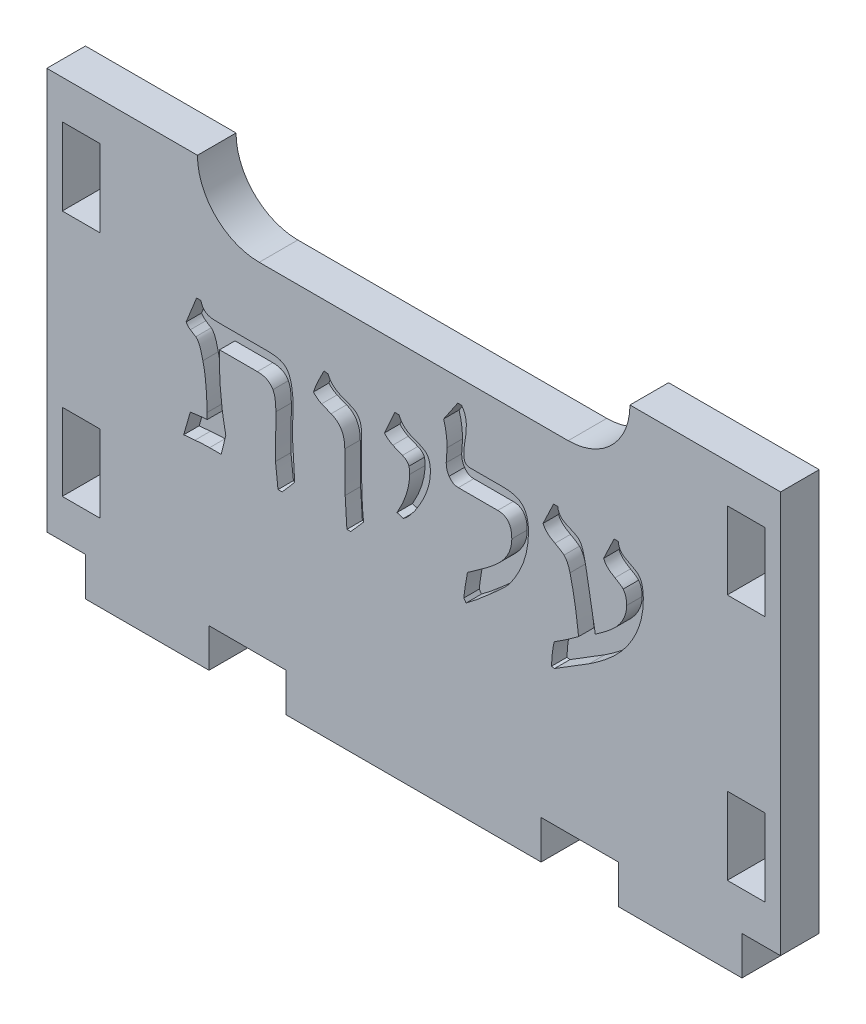
from build123d import *

# Parameters (mm, degrees)
SKETCH1_W           = 120.65
SKETCH1_H           = 66.04
BOSS_EXTRUDE1_DEPTH = 6.35
CUT_EXTRUDE1_REACH  = 139.688
SKETCH2_W           = 6.223
SKETCH2_H           = 12.7
SKETCH4_W           = 20.32
SKETCH4_H           = 6.35
SKETCH4_W_2         = 41.91
BOSS_EXTRUDE2_DEPTH = 6.35
CUT_EXTRUDE2_DEPTH  = 2.54
CUT_EXTRUDE3_DEPTH  = 138.688149952


with BuildPart() as part:
    # Sketch1 → Boss-Extrude1 (new body)
    with BuildSketch(Plane.XY):
        with Locations((-60.325, 33.02)):
            Rectangle(SKETCH1_W, SKETCH1_H)
    extrude(amount=BOSS_EXTRUDE1_DEPTH)

    # Sketch2 → Cut-Extrude1 (cut, up to next)
    with BuildSketch(Plane.XY.offset(6.35), mode=Mode.PRIVATE) as cut_extrude1_sk1:
        with Locations((-114.9985, 12.7)):
            Rectangle(SKETCH2_W, SKETCH2_H)
    cut_extrude1_tool1 = extrude(cut_extrude1_sk1.sketch, amount=-CUT_EXTRUDE1_REACH, mode=Mode.PRIVATE) & part.part
    # Sketch2 → Cut-Extrude1 (cut, up to next)
    with BuildSketch(Plane.XY.offset(6.35), mode=Mode.PRIVATE) as cut_extrude1_sk2:
        with Locations((-114.9985, 53.34)):
            Rectangle(SKETCH2_W, SKETCH2_H)
    cut_extrude1_tool2 = extrude(cut_extrude1_sk2.sketch, amount=-CUT_EXTRUDE1_REACH, mode=Mode.PRIVATE) & part.part
    # Sketch2 → Cut-Extrude1 (cut, up to next)
    with BuildSketch(Plane.XY.offset(6.35), mode=Mode.PRIVATE) as cut_extrude1_sk3:
        with Locations((-5.6515, 53.34)):
            Rectangle(SKETCH2_W, SKETCH2_H)
    cut_extrude1_tool3 = extrude(cut_extrude1_sk3.sketch, amount=-CUT_EXTRUDE1_REACH, mode=Mode.PRIVATE) & part.part
    # Sketch2 → Cut-Extrude1 (cut, up to next)
    with BuildSketch(Plane.XY.offset(6.35), mode=Mode.PRIVATE) as cut_extrude1_sk4:
        with Locations((-5.6515, 12.7)):
            Rectangle(SKETCH2_W, SKETCH2_H)
    cut_extrude1_tool4 = extrude(cut_extrude1_sk4.sketch, amount=-CUT_EXTRUDE1_REACH, mode=Mode.PRIVATE) & part.part
    add(cut_extrude1_tool1.solids().sort_by_distance((-114.9985, 12.7, 6.35))[0], mode=Mode.SUBTRACT)
    add(cut_extrude1_tool2.solids().sort_by_distance((-114.9985, 53.34, 6.35))[0], mode=Mode.SUBTRACT)
    add(cut_extrude1_tool3.solids().sort_by_distance((-5.6515, 53.34, 6.35))[0], mode=Mode.SUBTRACT)
    add(cut_extrude1_tool4.solids().sort_by_distance((-5.6515, 12.7, 6.35))[0], mode=Mode.SUBTRACT)

    # Sketch4 → Boss-Extrude2 (add)
    with BuildSketch(Plane.XZ):
        with Locations((-104.14, 3.175)):
            Rectangle(SKETCH4_W, SKETCH4_H)
        with Locations((-60.325, 3.175)):
            Rectangle(SKETCH4_W_2, SKETCH4_H)
        with Locations((-16.51, 3.175)):
            Rectangle(SKETCH4_W, SKETCH4_H)
    extrude(amount=BOSS_EXTRUDE2_DEPTH)

    # Sketch5 → Cut-Extrude2 (cut)
    with BuildSketch(Plane.XY.offset(6.35)):
        with BuildLine():
            Line((-79.889864865, 27.459459459), (-81.9546875, 25.056756757))
            Line((-81.9546875, 25.056756757), (-82.635810811, 25.056756757))
            add(Edge.make_bspline(
                [(-82.635810811, 25.056756757), (-82.66785403, 25.321355932), (-82.728474935, 25.821937403), (-82.815807836, 26.525912845), (-82.883777393, 27.139518484), (-82.944656922, 27.657547335), (-82.987732743, 28.085037315), (-83.017829441, 28.419469819), (-83.044236958, 28.662214683), (-83.047519022, 28.793069779), (-83.048775338, 28.843158784)],
                knots=[0, 0, 0, 0, 1.679180359, 3.176754326, 4.469037184, 5.568533053, 6.462846369, 7.175614727, 7.684439976, 8, 8, 8, 8], degree=3))
            add(Edge.make_bspline(
                [(-83.048775338, 28.843158784), (-83.048721642, 28.907516445), (-83.048593369, 29.061259747), (-83.049963924, 29.3276564), (-83.042569362, 29.665500872), (-83.036290532, 30.074880275), (-83.03954267, 30.55581301), (-83.033417953, 31.110033186), (-83.019179299, 31.73563996), (-83.019158491, 32.409722006), (-83.00427573, 33.083602649), (-83.001240043, 33.7093546), (-82.995521397, 34.261757653), (-82.989985502, 34.740867425), (-82.985576861, 35.148478817), (-82.977832261, 35.484533825), (-82.979237527, 35.747355103), (-82.979108017, 35.897522963), (-82.979054054, 35.960092905)],
                knots=[0, 0, 0, 0, 0.434034008, 1.036859018, 1.796514212, 2.712887544, 3.797972563, 5.03985061, 6.450667213, 8.018058611, 9.585589113, 10.99625116, 12.238129207, 13.311225457, 14.227598788, 14.987253982, 15.578022493, 16, 16, 16, 16], degree=3))
            add(Edge.make_bspline(
                [(-82.979054054, 35.960092905), (-82.984562785, 36.269726875), (-82.994812325, 36.845831546), (-83.084727141, 37.644541156), (-83.224723972, 38.317519113), (-83.39512149, 38.69909645), (-83.472466216, 38.872297297)],
                knots=[0, 0, 0, 0, 1.246985142, 2.320139378, 3.237498526, 4, 4, 4, 4], degree=3))
            add(Edge.make_bspline(
                [(-83.472466216, 38.872297297), (-83.533764513, 38.974552732), (-83.655089306, 39.176942033), (-83.888638382, 39.440072179), (-84.156178362, 39.663999403), (-84.459139313, 39.848679187), (-84.802331853, 39.986585879), (-85.180012404, 40.089382851), (-85.594559741, 40.146518379), (-85.882153715, 40.155051799), (-86.030701014, 40.159459459)],
                knots=[0, 0, 0, 0, 0.946425686, 1.873215192, 2.781502285, 3.712859963, 4.681761181, 5.712908682, 6.818677477, 8, 8, 8, 8], degree=3))
            Line((-86.030701014, 40.159459459), (-92.246621622, 40.159459459))
            add(Edge.make_bspline(
                [(-92.246621622, 40.159459459), (-92.252568678, 40.079041379), (-92.265641278, 39.902269319), (-92.273273315, 39.608830787), (-92.287565114, 39.263922043), (-92.28534534, 39.015335438), (-92.284163851, 38.883023649)],
                knots=[0, 0, 0, 0, 0.757447694, 1.664993594, 2.757178112, 4, 4, 4, 4], degree=3))
            add(Edge.make_bspline(
                [(-92.284163851, 38.883023649), (-92.273292899, 37.986913462), (-92.25178244, 36.213771421), (-92.034816977, 33.583234121), (-91.716620544, 31.008118536), (-91.382543633, 29.324172392), (-91.216891892, 28.489189189)],
                knots=[0, 0, 0, 0, 1.027131953, 2.032396099, 3.024365349, 4, 4, 4, 4], degree=3))
            add(Edge.make_bspline(
                [(-91.216891892, 28.489189189), (-91.262414043, 28.278018135), (-91.360660168, 27.822267752), (-91.539484201, 27.09718011), (-91.749770385, 26.278665983), (-91.902903596, 25.70379007), (-91.983826014, 25.4)],
                knots=[0, 0, 0, 0, 0.814282498, 1.757388394, 2.814904016, 4, 4, 4, 4], degree=3))
            Line((-91.983826014, 25.4), (-93.887753378, 25.4))
            add(Edge.make_bspline(
                [(-93.887753378, 25.4), (-94.057628893, 25.399684922), (-94.419036056, 25.399014601), (-94.989127995, 25.366363367), (-95.618998468, 25.333226048), (-96.056377939, 25.292552724), (-96.285092905, 25.271283784)],
                knots=[0, 0, 0, 0, 0.848634405, 1.805454731, 2.852425909, 4, 4, 4, 4], degree=3))
            Line((-96.285092905, 25.271283784), (-98.140751689, 25.110388514))
            Line((-98.140751689, 25.110388514), (-97.052027027, 28.896790541))
            add(Edge.make_bspline(
                [(-97.052027027, 28.896790541), (-96.869610377, 28.917807187), (-96.529676238, 28.95697179), (-96.058332703, 29.017703131), (-95.66257041, 29.064904462), (-95.347557884, 29.104007711), (-95.105489167, 29.128106361), (-94.954576837, 29.170161185), (-94.855204508, 29.150843738), (-94.833428203, 29.173822789), (-94.831672297, 29.175675676)],
                knots=[0, 0, 0, 0, 1.967693249, 3.666804041, 5.095015566, 6.233323303, 7.08411999, 7.663975879, 7.972905114, 8, 8, 8, 8], degree=3))
            Line((-94.831672297, 29.175675676), (-94.306081081, 29.175675676))
            Line((-94.306081081, 29.175675676), (-94.306081081, 30.194679054))
            add(Edge.make_bspline(
                [(-94.306081081, 30.194679054), (-94.308078576, 30.536160105), (-94.312001278, 31.206764004), (-94.344544499, 32.190302984), (-94.39771272, 33.132753336), (-94.472607259, 34.034103319), (-94.567500175, 34.89460695), (-94.686554134, 35.713635767), (-94.822874577, 36.490688015), (-94.936937553, 36.992021688), (-94.992567568, 37.236528716)],
                knots=[0, 0, 0, 0, 1.155781368, 2.269734997, 3.330366347, 4.350437698, 5.330698874, 6.260016284, 7.151387052, 8, 8, 8, 8], degree=3))
            add(Edge.make_bspline(
                [(-94.992567568, 37.236528716), (-95.034035749, 37.428146987), (-95.112651987, 37.791420878), (-95.246139384, 38.301606697), (-95.385559387, 38.74909943), (-95.527304627, 39.135556799), (-95.677228398, 39.458106261), (-95.826349412, 39.721805756), (-95.983012177, 39.925388506), (-96.106230619, 40.020207052), (-96.161739865, 40.062922297)],
                knots=[0, 0, 0, 0, 1.511924906, 2.866338598, 4.065540048, 5.125749369, 6.038648832, 6.804820916, 7.461578243, 8, 8, 8, 8], degree=3))
            add(Edge.make_bspline(
                [(-96.161739865, 40.062922297), (-96.277949568, 40.134417908), (-96.483736005, 40.261023749), (-96.748988706, 40.424433934), (-96.9272465, 40.537896865), (-97.01629138, 40.595635292), (-97.046663851, 40.615329392)],
                knots=[0, 0, 0, 0, 1.569471622, 2.779251348, 3.583612742, 4, 4, 4, 4], degree=3))
            add(Edge.make_bspline(
                [(-97.046663851, 40.615329392), (-97.194952258, 40.730795143), (-97.470043514, 40.944996774), (-97.653807715, 41.240629112), (-97.738513514, 41.376900338)],
                knots=[0, 0, 0, 0, 1.07810338, 2, 2, 2, 2], degree=3))
            Line((-97.738513514, 41.376900338), (-96.022297297, 45.651351351))
            Line((-96.022297297, 45.651351351), (-95.335810811, 45.651351351))
            add(Edge.make_bspline(
                [(-95.335810811, 45.651351351), (-95.280301561, 45.473200419), (-95.175026553, 45.135331671), (-94.91488445, 44.696674785), (-94.578909821, 44.352126974), (-94.300439237, 44.220703421), (-94.161275338, 44.155025338)],
                knots=[0, 0, 0, 0, 1.129898989, 2.14288835, 3.071920292, 4, 4, 4, 4], degree=3))
            add(Edge.make_bspline(
                [(-94.161275338, 44.155025338), (-94.052927494, 44.119930309), (-93.799775858, 44.03793178), (-93.345897175, 43.979209681), (-92.776438143, 43.945059116), (-92.357562802, 43.938642213), (-92.128631757, 43.935135135)],
                knots=[0, 0, 0, 0, 0.664464924, 1.552503278, 2.66235147, 4, 4, 4, 4], degree=3))
            Line((-92.128631757, 43.935135135), (-84.271579392, 43.935135135))
            add(Edge.make_bspline(
                [(-84.271579392, 43.935135135), (-84.092702612, 43.931936328), (-83.74871247, 43.92578484), (-83.256173884, 43.882449215), (-82.808533221, 43.816673984), (-82.408731525, 43.71328148), (-82.053214336, 43.587162364), (-81.742161925, 43.430531367), (-81.474792525, 43.245123728), (-81.332002737, 43.092136471), (-81.262837838, 43.018032095)],
                knots=[0, 0, 0, 0, 1.325602991, 2.549209354, 3.662372855, 4.674681574, 5.605210044, 6.452593117, 7.250462924, 8, 8, 8, 8], degree=3))
            add(Edge.make_bspline(
                [(-81.262837838, 43.018032095), (-81.173425504, 42.907905659), (-80.98499665, 42.675823607), (-80.760942474, 42.252431529), (-80.577764233, 41.74968462), (-80.422393896, 41.168292662), (-80.309136183, 40.507386312), (-80.224399051, 39.767954357), (-80.170089401, 38.948185926), (-80.165688129, 38.373612692), (-80.163386824, 38.073184122)],
                knots=[0, 0, 0, 0, 0.658412586, 1.387548258, 2.213599601, 3.143212901, 4.181945257, 5.32857397, 6.603184665, 8, 8, 8, 8], degree=3))
            add(Edge.make_bspline(
                [(-80.163386824, 38.073184122), (-80.163046109, 38.037423824), (-80.162211063, 37.949780276), (-80.17162817, 37.794377483), (-80.166712974, 37.592241992), (-80.174381728, 37.341946427), (-80.185652368, 37.047061652), (-80.196325969, 36.703807266), (-80.206866348, 36.315865433), (-80.213519377, 36.040542614), (-80.217018581, 35.895734797)],
                knots=[0, 0, 0, 0, 0.393945428, 0.965505806, 1.714002119, 2.620290678, 3.724041126, 4.965594377, 6.404034739, 8, 8, 8, 8], degree=3))
            add(Edge.make_bspline(
                [(-80.217018581, 35.895734797), (-80.224676031, 35.647258962), (-80.239437949, 35.168250971), (-80.252564407, 34.47809782), (-80.244945186, 33.845163187), (-80.236923258, 33.442968856), (-80.233108108, 33.251689189)],
                knots=[0, 0, 0, 0, 1.128036325, 2.174611517, 3.131863199, 4, 4, 4, 4], degree=3))
            add(Edge.make_bspline(
                [(-80.233108108, 33.251689189), (-80.230042562, 33.126529066), (-80.223077051, 32.842141125), (-80.198114781, 32.365024558), (-80.176302782, 31.788915034), (-80.125380225, 31.113911718), (-80.090607547, 30.340804014), (-80.025056123, 29.469019396), (-79.964166974, 28.497940587), (-79.915444184, 27.816968017), (-79.889864865, 27.459459459)],
                knots=[0, 0, 0, 0, 0.517785574, 1.176508693, 1.975907315, 2.902038157, 3.975787001, 5.176360088, 6.517597514, 8, 8, 8, 8], degree=3))
        make_face()
        with BuildLine():
            Line((-68.562837838, 27.459459459), (-70.675929054, 25.056756757))
            Line((-70.675929054, 25.056756757), (-71.308783784, 25.056756757))
            add(Edge.make_bspline(
                [(-71.308783784, 25.056756757), (-71.317524867, 25.185486841), (-71.336223705, 25.460864952), (-71.370558312, 25.902159484), (-71.400212494, 26.401228452), (-71.439750018, 26.956962345), (-71.476549212, 27.570211336), (-71.514487092, 28.240593444), (-71.550354425, 28.970169985), (-71.578441567, 29.47602884), (-71.593032095, 29.738809122)],
                knots=[0, 0, 0, 0, 0.660150716, 1.41218782, 2.264602325, 3.218014702, 4.262705963, 5.407838729, 6.653440849, 8, 8, 8, 8], degree=3))
            add(Edge.make_bspline(
                [(-71.593032095, 29.738809122), (-71.598990411, 29.880022243), (-71.612562326, 30.201678991), (-71.619790012, 30.741732293), (-71.633066316, 31.397763715), (-71.635583982, 32.166547439), (-71.641929377, 33.049671023), (-71.64657519, 34.045439417), (-71.653627135, 35.157395949), (-71.65257804, 35.936851096), (-71.652027027, 36.346241554)],
                knots=[0, 0, 0, 0, 0.513313115, 1.16923007, 1.96147694, 2.896484917, 3.961349232, 5.169056203, 6.513113445, 8, 8, 8, 8], degree=3))
            add(Edge.make_bspline(
                [(-71.652027027, 36.346241554), (-71.65969018, 36.586126911), (-71.674404722, 37.046747111), (-71.772996917, 37.705700604), (-71.94949837, 38.296814555), (-72.198382001, 38.820332243), (-72.518153289, 39.280427576), (-72.914888544, 39.667435023), (-73.378144908, 39.99505304), (-73.729527153, 40.142669356), (-73.909923986, 40.218454392)],
                knots=[0, 0, 0, 0, 1.198315691, 2.300967508, 3.318023051, 4.268689061, 5.185401603, 6.101069557, 7.025104304, 8, 8, 8, 8], degree=3))
            add(Edge.make_bspline(
                [(-73.909923986, 40.218454392), (-74.096043455, 40.289471647), (-74.431355759, 40.417416131), (-74.876417328, 40.594601738), (-75.210420676, 40.730997418), (-75.3921831, 40.816814001), (-75.465244932, 40.851309122)],
                knots=[0, 0, 0, 0, 1.423232872, 2.564092285, 3.422817729, 4, 4, 4, 4], degree=3))
            add(Edge.make_bspline(
                [(-75.465244932, 40.851309122), (-75.601130691, 40.923453043), (-75.864191044, 41.063115988), (-76.217703336, 41.314648768), (-76.537363138, 41.575167356), (-76.713823047, 41.776554161), (-76.800675676, 41.875675676)],
                knots=[0, 0, 0, 0, 1.088336468, 2.10690347, 3.068227956, 4, 4, 4, 4], degree=3))
            add(Edge.make_bspline(
                [(-76.800675676, 41.875675676), (-76.763921173, 41.990358268), (-76.685908471, 42.233776029), (-76.544392295, 42.616529578), (-76.373762881, 43.039106916), (-76.16697173, 43.497573313), (-75.942781347, 44.000270658), (-75.685569858, 44.540444337), (-75.393743248, 45.119519533), (-75.19009591, 45.519142432), (-75.084459459, 45.726435811)],
                knots=[0, 0, 0, 0, 0.684712745, 1.45332644, 2.3197731, 3.27553597, 4.312854072, 5.449606447, 6.677053547, 8, 8, 8, 8], degree=3))
            Line((-75.084459459, 45.726435811), (-74.397972973, 45.651351351))
            add(Edge.make_bspline(
                [(-74.397972973, 45.651351351), (-74.350432367, 45.537492429), (-74.255934868, 45.311172565), (-74.069924232, 44.994391574), (-73.857121809, 44.693853461), (-73.594735286, 44.428165815), (-73.306042292, 44.179345273), (-72.979227703, 43.958725264), (-72.618741906, 43.758656352), (-72.359301332, 43.648525494), (-72.225886824, 43.591891892)],
                knots=[0, 0, 0, 0, 0.958317934, 1.904869452, 2.850195395, 3.813641018, 4.799684404, 5.809829576, 6.873728554, 8, 8, 8, 8], degree=3))
            add(Edge.make_bspline(
                [(-72.225886824, 43.591891892), (-72.06995361, 43.535738881), (-71.772829489, 43.428741702), (-71.356655096, 43.260313284), (-70.984233208, 43.109840846), (-70.65771918, 42.974845543), (-70.382101861, 42.838421937), (-70.154347794, 42.71513764), (-69.966038001, 42.612348796), (-69.867055174, 42.532981246), (-69.823184122, 42.497804054)],
                knots=[0, 0, 0, 0, 1.501745556, 2.861512403, 4.067866281, 5.142108415, 6.062253119, 6.852258182, 7.491299216, 8, 8, 8, 8], degree=3))
            add(Edge.make_bspline(
                [(-69.823184122, 42.497804054), (-69.749904828, 42.431647126), (-69.602986027, 42.299008066), (-69.412778832, 42.065641808), (-69.258681774, 41.799626153), (-69.128570144, 41.506758577), (-69.026759781, 41.184982413), (-68.959029238, 40.832150932), (-68.915717256, 40.451928952), (-68.909359371, 40.188187743), (-68.906081081, 40.052195946)],
                knots=[0, 0, 0, 0, 0.876831871, 1.757973936, 2.662873769, 3.60201546, 4.60223751, 5.655712014, 6.791224401, 8, 8, 8, 8], degree=3))
            add(Edge.make_bspline(
                [(-68.906081081, 40.052195946), (-68.906081081, 39.910965653), (-68.906081081, 39.603476914), (-68.906081081, 39.101126126), (-68.906081081, 38.520115428), (-68.906081081, 37.889048423), (-68.906081081, 37.266920045), (-68.906081081, 36.7109375), (-68.906081081, 36.249704392), (-68.906081081, 35.974394707), (-68.906081081, 35.852829392)],
                knots=[0, 0, 0, 0, 0.80715198, 1.75734355, 2.87100894, 4.127713921, 5.363984674, 6.426564496, 7.305236271, 8, 8, 8, 8], degree=3))
            add(Edge.make_bspline(
                [(-68.906081081, 35.852829392), (-68.905143638, 35.382652518), (-68.903339982, 34.478023701), (-68.887091533, 33.171138378), (-68.861117478, 31.967911884), (-68.824059995, 30.866567362), (-68.776682806, 29.868840904), (-68.718435748, 28.974789466), (-68.651088504, 28.182304999), (-68.590976069, 27.689934715), (-68.562837838, 27.459459459)],
                knots=[0, 0, 0, 0, 1.342516136, 2.583025349, 3.73184102, 4.778891276, 5.729455327, 6.583768653, 7.337071524, 8, 8, 8, 8], degree=3))
        make_face()
        with BuildLine():
            add(Edge.make_bspline(
                [(-57.579054054, 40.068285473), (-57.58497832, 39.866095325), (-57.597022276, 39.45504533), (-57.672574341, 38.829992961), (-57.811353829, 38.189828271), (-57.995174834, 37.529544752), (-58.222008073, 36.847764864), (-58.519214644, 36.155589519), (-58.854467788, 35.439252597), (-59.113850096, 34.964770483), (-59.247001689, 34.721199324)],
                knots=[0, 0, 0, 0, 0.857309814, 1.742899933, 2.664537085, 3.631764291, 4.64802541, 5.707976292, 6.823410083, 8, 8, 8, 8], degree=3))
            add(Edge.make_bspline(
                [(-59.247001689, 34.721199324), (-59.366980151, 34.512859527), (-59.598850707, 34.110221721), (-59.961216242, 33.54147048), (-60.309695799, 33.018945067), (-60.666736554, 32.560078634), (-61.008051985, 32.146623454), (-61.354142479, 31.792019783), (-61.691441629, 31.484528184), (-61.928753105, 31.315322545), (-62.041216216, 31.235135135)],
                knots=[0, 0, 0, 0, 1.280911276, 2.475491065, 3.593146524, 4.62585021, 5.572354112, 6.448143302, 7.26456725, 8, 8, 8, 8], degree=3))
            Line((-62.041216216, 31.235135135), (-63.070945946, 31.573015203))
            add(Edge.make_bspline(
                [(-63.070945946, 31.573015203), (-62.906776673, 31.86267786), (-62.585664663, 32.429252568), (-62.170975504, 33.287059544), (-61.810413744, 34.122483779), (-61.52318547, 34.940372978), (-61.293461578, 35.73842776), (-61.133129819, 36.516502409), (-61.030945839, 37.274923945), (-61.017894849, 37.774330994), (-61.011486486, 38.019552365)],
                knots=[0, 0, 0, 0, 1.16727949, 2.283176719, 3.339308336, 4.35646626, 5.320927941, 6.249197264, 7.140311997, 8, 8, 8, 8], degree=3))
            add(Edge.make_bspline(
                [(-61.011486486, 38.019552365), (-61.01253888, 38.150062659), (-61.014457255, 38.387965613), (-61.026929666, 38.708711383), (-61.057593759, 38.957969304), (-61.089307965, 39.097710796), (-61.102660473, 39.156545608)],
                knots=[0, 0, 0, 0, 1.369697807, 2.496777428, 3.367104093, 4, 4, 4, 4], degree=3))
            add(Edge.make_bspline(
                [(-61.102660473, 39.156545608), (-61.146757881, 39.265600503), (-61.235384832, 39.484778984), (-61.48371364, 39.756222963), (-61.794158706, 39.993959619), (-62.043499909, 40.10223024), (-62.175295608, 40.159459459)],
                knots=[0, 0, 0, 0, 0.924012154, 1.85707924, 2.86730417, 4, 4, 4, 4], degree=3))
            add(Edge.make_bspline(
                [(-62.175295608, 40.159459459), (-62.364739176, 40.234676701), (-62.706292163, 40.370287921), (-63.162448824, 40.549389613), (-63.501354721, 40.694506895), (-63.687817232, 40.779564434), (-63.762795608, 40.813766892)],
                knots=[0, 0, 0, 0, 1.424306726, 2.567921532, 3.424147421, 4, 4, 4, 4], degree=3))
            add(Edge.make_bspline(
                [(-63.762795608, 40.813766892), (-63.901800688, 40.890135203), (-64.170370565, 41.037685407), (-64.540147221, 41.290400514), (-64.858266083, 41.570316129), (-65.041135604, 41.775508652), (-65.130405405, 41.875675676)],
                knots=[0, 0, 0, 0, 1.091511593, 2.108895115, 3.076836015, 4, 4, 4, 4], degree=3))
            add(Edge.make_bspline(
                [(-65.130405405, 41.875675676), (-65.076229301, 41.986257182), (-64.962227589, 42.218951671), (-64.793506192, 42.592065404), (-64.595832403, 43.000252944), (-64.391060807, 43.451992386), (-64.167365818, 43.944510832), (-63.935792967, 44.480009663), (-63.675356864, 45.050947736), (-63.502958854, 45.447276984), (-63.414189189, 45.651351351)],
                knots=[0, 0, 0, 0, 0.712484684, 1.499267515, 2.369177506, 3.336581618, 4.369049288, 5.499190202, 6.712305038, 8, 8, 8, 8], degree=3))
            Line((-63.414189189, 45.651351351), (-62.727702703, 45.651351351))
            add(Edge.make_bspline(
                [(-62.727702703, 45.651351351), (-62.680391138, 45.535601226), (-62.58696099, 45.307019666), (-62.399530091, 44.989083383), (-62.18688739, 44.688470716), (-61.924447393, 44.422825561), (-61.635806676, 44.173908047), (-61.308831091, 43.953648049), (-60.949608862, 43.752488572), (-60.68920353, 43.646343779), (-60.555616554, 43.591891892)],
                knots=[0, 0, 0, 0, 0.970172071, 1.915880816, 2.860365078, 3.822952885, 4.808118336, 5.817364113, 6.880315837, 8, 8, 8, 8], degree=3))
            add(Edge.make_bspline(
                [(-60.555616554, 43.591891892), (-60.414266219, 43.538577935), (-60.145252813, 43.43711253), (-59.761917918, 43.286878565), (-59.419800509, 43.143309551), (-59.118439336, 43.005292051), (-58.861076282, 42.868961419), (-58.639987307, 42.748631768), (-58.459834385, 42.630905099), (-58.359632594, 42.546932209), (-58.313809122, 42.508530405)],
                knots=[0, 0, 0, 0, 1.449963152, 2.75952319, 3.95138556, 5.010770744, 5.939388824, 6.746017368, 7.426538805, 8, 8, 8, 8], degree=3))
            add(Edge.make_bspline(
                [(-58.313809122, 42.508530405), (-58.25470497, 42.445737099), (-58.133660462, 42.317137251), (-57.98493771, 42.090187598), (-57.860976368, 41.831198303), (-57.753219947, 41.543118489), (-57.673349327, 41.21914055), (-57.624306876, 40.86308883), (-57.582514177, 40.476841278), (-57.580236143, 40.207861295), (-57.579054054, 40.068285473)],
                knots=[0, 0, 0, 0, 0.790390688, 1.618709519, 2.477356297, 3.422298148, 4.437175457, 5.532569598, 6.719631017, 8, 8, 8, 8], degree=3))
        make_face()
        with BuildLine():
            add(Edge.make_bspline(
                [(-41.446621622, 39.596326014), (-41.457842635, 39.199027303), (-41.480211828, 38.407008656), (-41.632971767, 37.225240925), (-41.893946721, 36.060579304), (-42.246426622, 34.906750785), (-42.712122981, 33.772752982), (-43.278203154, 32.654706486), (-43.944339585, 31.5494936), (-44.457162046, 30.843566355), (-44.718158784, 30.484290541)],
                knots=[0, 0, 0, 0, 0.967274877, 1.928271393, 2.895634406, 3.8704016, 4.862172978, 5.876347502, 6.919184678, 8, 8, 8, 8], degree=3))
            add(Edge.make_bspline(
                [(-44.718158784, 30.484290541), (-44.774604936, 30.415682929), (-44.905808724, 30.25621097), (-45.152190801, 30.001234333), (-45.459830806, 29.683038822), (-45.851541737, 29.320243567), (-46.309928485, 28.897214484), (-46.843629029, 28.421101904), (-47.440957581, 27.882520795), (-47.87084678, 27.513902411), (-48.096959459, 27.320016892)],
                knots=[0, 0, 0, 0, 0.460045592, 1.069332839, 1.835484985, 2.752588851, 3.833992214, 5.066769608, 6.457182493, 8, 8, 8, 8], degree=3))
            add(Edge.make_bspline(
                [(-48.096959459, 27.320016892), (-48.314865739, 27.132073154), (-48.730561263, 26.77353658), (-49.326988428, 26.265381179), (-49.858866458, 25.805539053), (-50.346931144, 25.417348126), (-50.765907157, 25.071740095), (-51.133183194, 24.789003166), (-51.436082414, 24.553583206), (-51.627071524, 24.426574941), (-51.711739865, 24.37027027)],
                knots=[0, 0, 0, 0, 1.479541071, 2.822491408, 4.028863593, 5.094044901, 6.028587189, 6.821058897, 7.477357705, 8, 8, 8, 8], degree=3))
            Line((-51.711739865, 24.37027027), (-52.087162162, 24.890498311))
            add(Edge.make_bspline(
                [(-52.087162162, 24.890498311), (-52.060023918, 25.144535533), (-52.000280376, 25.703786271), (-51.867811949, 26.613559939), (-51.695140149, 27.673633281), (-51.559198469, 28.428612136), (-51.486486486, 28.832432432)],
                knots=[0, 0, 0, 0, 0.76860356, 1.692043803, 2.765528928, 4, 4, 4, 4], degree=3))
            add(Edge.make_bspline(
                [(-51.486486486, 28.832432432), (-50.965987803, 29.200322703), (-49.922109638, 29.938139402), (-48.881497186, 30.680554959), (-48.359755068, 31.052787162)],
                knots=[0, 0, 0, 0, 0.997240293, 2, 2, 2, 2], degree=3))
            add(Edge.make_bspline(
                [(-48.359755068, 31.052787162), (-48.055272464, 31.285825936), (-47.47495838, 31.729975063), (-46.682355545, 32.410495064), (-46.009805268, 33.072848062), (-45.631779443, 33.532823769), (-45.452913851, 33.750464527)],
                knots=[0, 0, 0, 0, 1.156704088, 2.204564938, 3.150477206, 4, 4, 4, 4], degree=3))
            add(Edge.make_bspline(
                [(-45.452913851, 33.750464527), (-45.259002253, 34.027236203), (-44.882406254, 34.564754879), (-44.492428754, 35.447244284), (-44.23967659, 36.344707853), (-44.208236665, 36.9542143), (-44.192567568, 37.257981419)],
                knots=[0, 0, 0, 0, 1.067502729, 2.073198612, 3.039716629, 4, 4, 4, 4], degree=3))
            add(Edge.make_bspline(
                [(-44.192567568, 37.257981419), (-44.199351351, 37.485456863), (-44.21209813, 37.912884933), (-44.315968538, 38.510897147), (-44.496693947, 39.019399609), (-44.750884108, 39.439501123), (-45.082248158, 39.770125401), (-45.494892835, 39.997364245), (-45.976212007, 40.141412431), (-46.322423285, 40.153248519), (-46.504096284, 40.159459459)],
                knots=[0, 0, 0, 0, 1.288535354, 2.42116762, 3.424298783, 4.329554724, 5.182028878, 6.04402082, 6.973607665, 8, 8, 8, 8], degree=3))
            Line((-46.504096284, 40.159459459), (-52.9828125, 40.159459459))
            add(Edge.make_bspline(
                [(-52.9828125, 40.159459459), (-53.136399461, 40.168847639), (-53.434943955, 40.187096514), (-53.855422438, 40.358964389), (-54.219296962, 40.641832624), (-54.404388432, 40.892594984), (-54.500591216, 41.022930743)],
                knots=[0, 0, 0, 0, 1.00676596, 1.95696583, 2.938116512, 4, 4, 4, 4], degree=3))
            add(Edge.make_bspline(
                [(-54.500591216, 41.022930743), (-54.574446926, 41.145993495), (-54.722953469, 41.393443882), (-54.872311775, 41.807476855), (-54.957606901, 42.251144346), (-54.971048821, 42.55642087), (-54.977913851, 42.712331081)],
                knots=[0, 0, 0, 0, 0.965790308, 1.941978224, 2.948931267, 4, 4, 4, 4], degree=3))
            add(Edge.make_bspline(
                [(-54.977913851, 42.712331081), (-54.976310654, 42.778481967), (-54.97275641, 42.925136657), (-54.962340548, 43.168441392), (-54.940555817, 43.454583423), (-54.897805171, 43.874163477), (-54.843279376, 44.364746481), (-54.83620788, 44.748415825), (-54.833108108, 44.916596284)],
                knots=[0, 0, 0, 0, 0.538964706, 1.194869895, 1.98333418, 2.875859696, 4.63054123, 6, 6, 6, 6], degree=3))
            add(Edge.make_bspline(
                [(-54.833108108, 44.916596284), (-54.84127224, 45.240416469), (-54.857594406, 45.887814945), (-54.960125729, 46.852750216), (-55.135764297, 47.806963435), (-55.309272451, 48.428834389), (-55.396241554, 48.740540541)],
                knots=[0, 0, 0, 0, 1.001951502, 2.003154543, 2.999102613, 4, 4, 4, 4], degree=3))
            Line((-55.396241554, 48.740540541), (-53.063260135, 52.172972973))
            Line((-53.063260135, 52.172972973), (-52.430405405, 52.135430743))
            add(Edge.make_bspline(
                [(-52.430405405, 52.135430743), (-52.313299939, 51.958335288), (-52.078755965, 51.603640727), (-51.838616425, 51.005464084), (-51.695562445, 50.359861017), (-51.677920471, 49.914058), (-51.668834459, 49.684459459)],
                knots=[0, 0, 0, 0, 0.974388204, 1.951547515, 2.945001083, 4, 4, 4, 4], degree=3))
            add(Edge.make_bspline(
                [(-51.668834459, 49.684459459), (-51.679908176, 49.320993584), (-51.702964095, 48.564243148), (-51.842793098, 47.624602083), (-51.968944472, 46.886153119), (-52.031338027, 46.392155111), (-52.08124771, 45.974150195), (-52.08533676, 45.717606833), (-52.087162162, 45.60308277)],
                knots=[0, 0, 0, 0, 1.592538219, 3.315728034, 4.156906197, 4.876110832, 5.498282267, 6, 6, 6, 6], degree=3))
            add(Edge.make_bspline(
                [(-52.087162162, 45.60308277), (-52.085065634, 45.429034854), (-52.081261434, 45.113220846), (-52.008531818, 44.694258593), (-51.918311634, 44.357972684), (-51.789961517, 44.202387562), (-51.733192568, 44.133572635)],
                knots=[0, 0, 0, 0, 1.349011261, 2.447812423, 3.313471161, 4, 4, 4, 4], degree=3))
            add(Edge.make_bspline(
                [(-51.733192568, 44.133572635), (-51.684241162, 44.102582314), (-51.571899612, 44.031460745), (-51.348341159, 43.97391724), (-51.064119289, 43.938369631), (-50.852037528, 43.936281275), (-50.735641892, 43.935135135)],
                knots=[0, 0, 0, 0, 0.670105263, 1.537865208, 2.648720457, 4, 4, 4, 4], degree=3))
            Line((-50.735641892, 43.935135135), (-45.629898649, 43.935135135))
            add(Edge.make_bspline(
                [(-45.629898649, 43.935135135), (-45.46536147, 43.933576), (-45.14654559, 43.930554938), (-44.684175586, 43.893148962), (-44.25640278, 43.828335631), (-43.862440035, 43.745747971), (-43.506205815, 43.631060598), (-43.18179411, 43.497962137), (-42.888774669, 43.339950774), (-42.719602669, 43.206400076), (-42.637246622, 43.141385135)],
                knots=[0, 0, 0, 0, 1.250787105, 2.42359079, 3.523139861, 4.538931326, 5.480339208, 6.363838747, 7.203486546, 8, 8, 8, 8], degree=3))
            add(Edge.make_bspline(
                [(-42.637246622, 43.141385135), (-42.54124302, 43.053051622), (-42.346382721, 42.873759444), (-42.105321886, 42.545122237), (-41.902068692, 42.17042932), (-41.728555283, 41.750895457), (-41.601704099, 41.278289189), (-41.515114897, 40.759033191), (-41.451666801, 40.193172252), (-41.448346014, 39.800322124), (-41.446621622, 39.596326014)],
                knots=[0, 0, 0, 0, 0.810117018, 1.644309603, 2.520454537, 3.458186612, 4.461994504, 5.557327451, 6.731588299, 8, 8, 8, 8], degree=3))
        make_face()
        with BuildLine():
            add(Edge.make_bspline(
                [(-22.568243243, 39.462246622), (-22.580425546, 39.052334191), (-22.604676517, 38.236332902), (-22.774257419, 37.023310972), (-23.059513365, 35.834832255), (-23.460776154, 34.668721369), (-23.97246929, 33.523868239), (-24.596445862, 32.399192641), (-25.341292262, 31.301342016), (-25.906081899, 30.603663896), (-26.19375, 30.248310811)],
                knots=[0, 0, 0, 0, 0.972386281, 1.935702359, 2.899615819, 3.868016476, 4.857203431, 5.871025168, 6.915634942, 8, 8, 8, 8], degree=3))
            add(Edge.make_bspline(
                [(-26.19375, 30.248310811), (-26.356681642, 30.0645437), (-26.689047124, 29.689675787), (-27.22793366, 29.142247119), (-27.813433012, 28.595270185), (-28.446786807, 28.047801156), (-29.130256694, 27.503532566), (-29.851710268, 26.948287837), (-30.627908894, 26.402263384), (-31.164640378, 26.044213637), (-31.438935811, 25.861233108)],
                knots=[0, 0, 0, 0, 0.859136392, 1.752558796, 2.686254801, 3.661811208, 4.680619239, 5.74268554, 6.846404456, 8, 8, 8, 8], degree=3))
            add(Edge.make_bspline(
                [(-31.438935811, 25.861233108), (-32.391944853, 25.271528194), (-34.302149041, 24.08952808), (-36.210527268, 22.904582148), (-37.166807432, 22.310810811)],
                knots=[0, 0, 0, 0, 0.997808557, 2, 2, 2, 2], degree=3))
            Line((-37.166807432, 22.310810811), (-37.670945946, 22.380532095))
            add(Edge.make_bspline(
                [(-37.670945946, 22.380532095), (-37.658134449, 22.698971636), (-37.632684234, 23.331556184), (-37.53708685, 24.268708415), (-37.413676675, 25.187924456), (-37.29168962, 25.788506642), (-37.231165541, 26.086486486)],
                knots=[0, 0, 0, 0, 1.023170131, 2.0325416, 3.023842261, 4, 4, 4, 4], degree=3))
            add(Edge.make_bspline(
                [(-37.231165541, 26.086486486), (-37.111249982, 26.159558705), (-36.856212837, 26.314969148), (-36.452990708, 26.567347747), (-36.008837129, 26.855916812), (-35.527984398, 27.184095027), (-35.00534345, 27.54434256), (-34.44246697, 27.941637133), (-33.838589638, 28.374815001), (-33.423148037, 28.676675197), (-33.208783784, 28.832432432)],
                knots=[0, 0, 0, 0, 0.691758735, 1.47123672, 2.34327564, 3.300776513, 4.338993723, 5.47026615, 6.694679333, 8, 8, 8, 8], degree=3))
            add(Edge.make_bspline(
                [(-33.208783784, 28.832432432), (-33.290763745, 29.571503708), (-33.45211205, 31.026101817), (-33.786605176, 33.160203411), (-34.158864701, 35.217546096), (-34.467498524, 36.552915891), (-34.619298986, 37.209712838)],
                knots=[0, 0, 0, 0, 1.0495187, 2.065603098, 3.048573672, 4, 4, 4, 4], degree=3))
            add(Edge.make_bspline(
                [(-34.619298986, 37.209712838), (-34.672590432, 37.424345729), (-34.773484644, 37.83070018), (-35.005335101, 38.382356421), (-35.264819145, 38.863459701), (-35.498912837, 39.11931689), (-35.611486486, 39.242356419)],
                knots=[0, 0, 0, 0, 1.156549943, 2.189642114, 3.129414414, 4, 4, 4, 4], degree=3))
            add(Edge.make_bspline(
                [(-35.611486486, 39.242356419), (-35.685447805, 39.306375079), (-35.857719592, 39.455488282), (-36.183773824, 39.670303015), (-36.604161463, 39.91599716), (-36.919403774, 40.083815406), (-37.091722973, 40.175548986)],
                knots=[0, 0, 0, 0, 0.66861453, 1.557346772, 2.664785683, 4, 4, 4, 4], degree=3))
            add(Edge.make_bspline(
                [(-37.091722973, 40.175548986), (-37.33965866, 40.315069348), (-37.800700622, 40.574510583), (-38.374860305, 41.039223108), (-38.811210245, 41.515575148), (-38.969756161, 41.877840866), (-39.043918919, 42.047297297)],
                knots=[0, 0, 0, 0, 1.232980747, 2.29275531, 3.201404998, 4, 4, 4, 4], degree=3))
            Line((-39.043918919, 42.047297297), (-37.327702703, 45.651351351))
            Line((-37.327702703, 45.651351351), (-36.641216216, 45.651351351))
            add(Edge.make_bspline(
                [(-36.641216216, 45.651351351), (-36.619143698, 45.501204348), (-36.576462037, 45.210864866), (-36.405233418, 44.811341046), (-36.177503171, 44.449182841), (-35.96196209, 44.26458194), (-35.852829392, 44.171114865)],
                knots=[0, 0, 0, 0, 1.052263293, 2.034763091, 3.004961813, 4, 4, 4, 4], degree=3))
            add(Edge.make_bspline(
                [(-35.852829392, 44.171114865), (-35.776652934, 44.119924068), (-35.598819905, 44.000419766), (-35.278208734, 43.829350697), (-34.871788277, 43.634975287), (-34.569837621, 43.506559908), (-34.404771959, 43.436359797)],
                knots=[0, 0, 0, 0, 0.676723828, 1.579803684, 2.676964941, 4, 4, 4, 4], degree=3))
            add(Edge.make_bspline(
                [(-34.404771959, 43.436359797), (-34.220742764, 43.35573408), (-33.881019058, 43.206896458), (-33.434787006, 42.95292433), (-33.09215657, 42.680760881), (-32.936898102, 42.467228418), (-32.865540541, 42.369087838)],
                knots=[0, 0, 0, 0, 1.267371558, 2.339607927, 3.236875566, 4, 4, 4, 4], degree=3))
            add(Edge.make_bspline(
                [(-32.865540541, 42.369087838), (-32.824755245, 42.292894058), (-32.734733616, 42.124718541), (-32.620909576, 41.829873686), (-32.495869351, 41.479086582), (-32.381547383, 41.059948385), (-32.256238428, 40.582052528), (-32.14241999, 40.036635996), (-32.017101887, 39.433112438), (-31.94029169, 39.008360825), (-31.900168919, 38.786486486)],
                knots=[0, 0, 0, 0, 0.55656307, 1.228450436, 2.033809036, 2.956566648, 4.026944837, 5.218034018, 6.546805139, 8, 8, 8, 8], degree=3))
            Line((-31.900168919, 38.786486486), (-30.462837838, 30.548648649))
            add(Edge.make_bspline(
                [(-30.462837838, 30.548648649), (-30.271431532, 30.682541735), (-29.901567721, 30.941269926), (-29.366364929, 31.320049695), (-28.882036494, 31.693951471), (-28.427436526, 32.03666117), (-28.027749297, 32.378806656), (-27.661145495, 32.694786477), (-27.332761562, 32.990660715), (-27.138386893, 33.193389834), (-27.046494932, 33.289231419)],
                knots=[0, 0, 0, 0, 1.278012206, 2.469565789, 3.586530523, 4.625352581, 5.583356356, 6.46388578, 7.273791447, 8, 8, 8, 8], degree=3))
            add(Edge.make_bspline(
                [(-27.046494932, 33.289231419), (-26.90783246, 33.446091396), (-26.638594142, 33.750663467), (-26.290131078, 34.234585164), (-25.982801528, 34.715312386), (-25.747628954, 35.210603123), (-25.54523885, 35.701579586), (-25.414411093, 36.203240648), (-25.329764138, 36.708048453), (-25.31936149, 37.046696702), (-25.314189189, 37.215076014)],
                knots=[0, 0, 0, 0, 1.142988931, 2.219320144, 3.254546123, 4.254767977, 5.210517391, 6.151026145, 7.080671625, 8, 8, 8, 8], degree=3))
            add(Edge.make_bspline(
                [(-25.314189189, 37.215076014), (-25.321352471, 37.430118468), (-25.334815974, 37.834294196), (-25.434176187, 38.398870736), (-25.602790339, 38.884572814), (-25.789075113, 39.145544032), (-25.877322635, 39.269172297)],
                knots=[0, 0, 0, 0, 1.18864268, 2.2340729, 3.163438385, 4, 4, 4, 4], degree=3))
            add(Edge.make_bspline(
                [(-25.877322635, 39.269172297), (-25.940304104, 39.331559702), (-26.088758687, 39.478614007), (-26.385626808, 39.686986598), (-26.773281761, 39.933381579), (-27.067183438, 40.103454013), (-27.228842905, 40.197001689)],
                knots=[0, 0, 0, 0, 0.646012478, 1.522725869, 2.637385066, 4, 4, 4, 4], degree=3))
            add(Edge.make_bspline(
                [(-27.228842905, 40.197001689), (-27.464023076, 40.335230629), (-27.903018577, 40.593253583), (-28.450785599, 41.05069674), (-28.862026995, 41.52590194), (-29.016840062, 41.880183757), (-29.089864865, 42.047297297)],
                knots=[0, 0, 0, 0, 1.219675299, 2.276688404, 3.187119723, 4, 4, 4, 4], degree=3))
            Line((-29.089864865, 42.047297297), (-27.373648649, 45.651351351))
            Line((-27.373648649, 45.651351351), (-26.687162162, 45.651351351))
            add(Edge.make_bspline(
                [(-26.687162162, 45.651351351), (-26.665451459, 45.50000867), (-26.623784157, 45.209550952), (-26.480610745, 44.804484204), (-26.278733477, 44.445460093), (-26.089380168, 44.255004017), (-25.9953125, 44.160388514)],
                knots=[0, 0, 0, 0, 1.089118484, 2.090242262, 3.051263183, 4, 4, 4, 4], degree=3))
            add(Edge.make_bspline(
                [(-25.9953125, 44.160388514), (-25.92644064, 44.107317019), (-25.769093328, 43.986067834), (-25.482157916, 43.814512289), (-25.128374204, 43.61550452), (-24.866036382, 43.481808246), (-24.724239865, 43.409543919)],
                knots=[0, 0, 0, 0, 0.7051107, 1.610923131, 2.708677323, 4, 4, 4, 4], degree=3))
            add(Edge.make_bspline(
                [(-24.724239865, 43.409543919), (-24.541936292, 43.319674023), (-24.204665231, 43.153410056), (-23.760937256, 42.878296943), (-23.409512721, 42.61414139), (-23.239406579, 42.411277064), (-23.163555743, 42.320819257)],
                knots=[0, 0, 0, 0, 1.269781781, 2.349162131, 3.263886473, 4, 4, 4, 4], degree=3))
            add(Edge.make_bspline(
                [(-23.163555743, 42.320819257), (-23.115279021, 42.244954859), (-23.014126526, 42.085998891), (-22.892399359, 41.815484312), (-22.791751036, 41.509634525), (-22.712581657, 41.16817088), (-22.649153269, 40.792009454), (-22.600502049, 40.380437368), (-22.575353871, 39.932729597), (-22.570675336, 39.623168892), (-22.568243243, 39.462246622)],
                knots=[0, 0, 0, 0, 0.728452308, 1.52630014, 2.39731193, 3.336136929, 4.365711889, 5.489560125, 6.694971042, 8, 8, 8, 8], degree=3))
        make_face()
    extrude(amount=-CUT_EXTRUDE2_DEPTH, mode=Mode.SUBTRACT)

    # Sketch7 → Cut-Extrude3 (cut, through all)
    with BuildSketch(Plane.XY.offset(6.35)):
        with BuildLine():
            Line((-85.725, 76.2), (-34.925, 76.2))
            ThreePointArc((-34.925, 76.2), (-24.765, 66.04), (-34.925, 55.88))
            Line((-34.925, 55.88), (-85.725, 55.88))
            ThreePointArc((-85.725, 55.88), (-95.885, 66.04), (-85.725, 76.2))
        make_face()
    extrude(amount=-CUT_EXTRUDE3_DEPTH, mode=Mode.SUBTRACT)


solid = part.part
